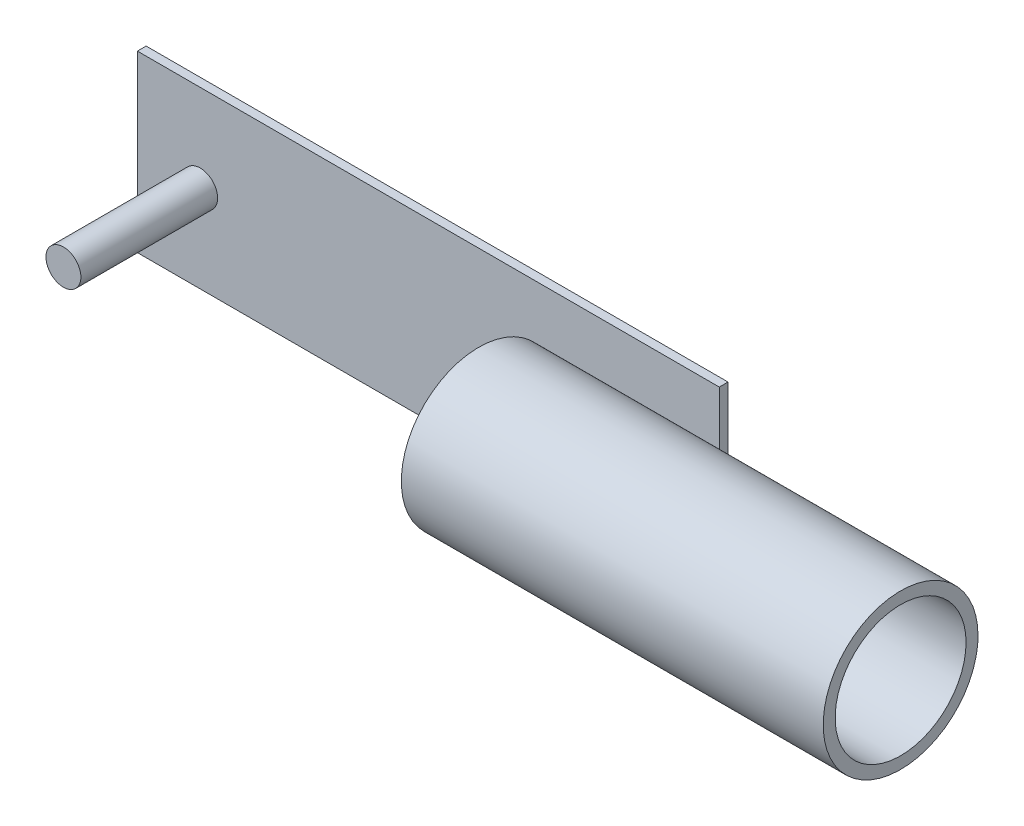
from build123d import *

# Parameters (mm, degrees)
EXTRUDE_1_DEPTH = 3
EXTRUDE_2_DEPTH = 50
SKETCH_2_R      = 26.59997625
SKETCH_2_R_2    = 22.5
EXTRUDE_3_DEPTH = 145


with BuildPart() as part:
    # 草图1 → 凸台-拉伸1 (new body)
    with BuildSketch(Plane(origin=(-45.881001885, 0, 0), x_dir=(1, 0, 0), z_dir=(0, 0, 1))):
        Polygon((-97.302904564, 60), (-97.302904564, 30), (-97.302904564, 0), (102.697095436, 0), (102.697095436, 60), align=None)
        with BuildLine():
            ThreePointArc((-69.721397193, 30), (-75.721397193, 24), (-81.721397193, 30))
            ThreePointArc((-81.721397193, 30), (-75.721397193, 36), (-69.721397193, 30))
        make_face(mode=Mode.SUBTRACT)
    extrude(amount=EXTRUDE_1_DEPTH)

    # 草图1<3> → 凸台-拉伸2 (add)
    with BuildSketch(Plane(origin=(-45.881001885, 0, 0), x_dir=(1, 0, 0), z_dir=(0, 0, 1))):
        with BuildLine():
            ThreePointArc((-69.721397193, 30), (-75.721397193, 36), (-81.721397193, 30))
            ThreePointArc((-81.721397193, 30), (-75.721397193, 24), (-69.721397193, 30))
        make_face()
    extrude(amount=EXTRUDE_2_DEPTH)

    # 草图2 → 凸台-拉伸3 (add)
    with BuildSketch(Plane(origin=(0, 0, 2.268932334), x_dir=(0, 0, -1), z_dir=(1, 0, 0))):
        with Locations((-26.59997625, 29.77500334)):
            Circle(SKETCH_2_R)
        with Locations((-26.59997625, 29.77500334)):
            Circle(SKETCH_2_R_2, mode=Mode.SUBTRACT)
    extrude(amount=EXTRUDE_3_DEPTH)


solid = part.part
